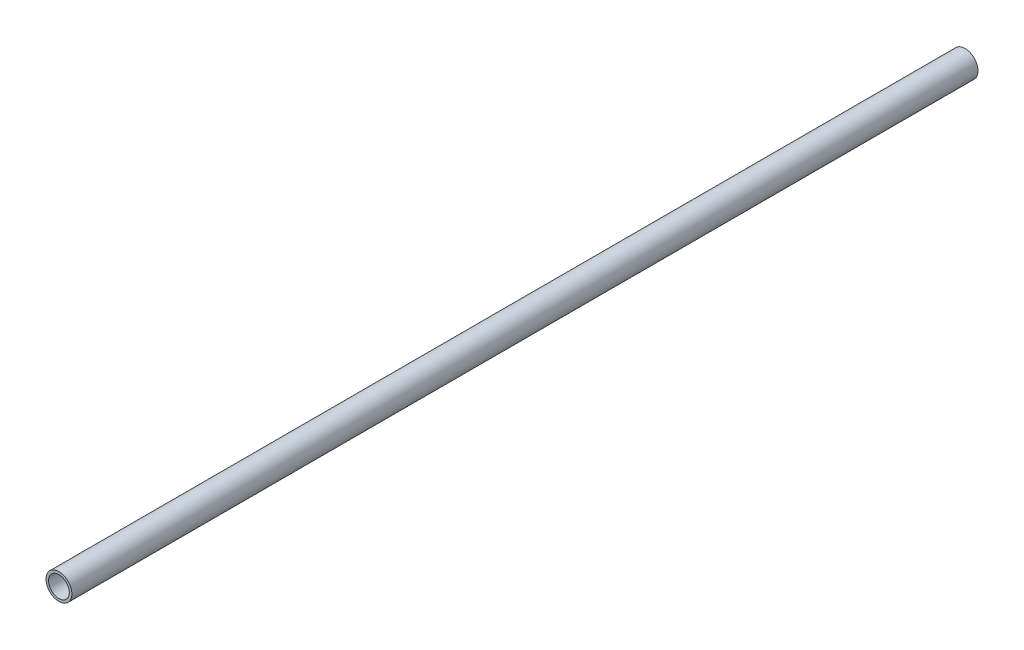
from build123d import *

# Parameters (mm, degrees)
SKETCH_1_R          = 5
EXTRUDE_1_DEPTH     = 350
SKETCH_2_R          = 4
CUT_EXTRUDE_1_DEPTH = 351.071421284


with BuildPart() as part:
    # 草图1 → 凸台-拉伸1 (new body)
    with BuildSketch(Plane.XY):
        Circle(SKETCH_1_R)
    extrude(amount=EXTRUDE_1_DEPTH)

    # 草图2 → 切除-拉伸1 (cut, through all)
    with BuildSketch(Plane(origin=(0, 0, 0), x_dir=(-1, 0, 0), z_dir=(0, 0, -1))):
        Circle(SKETCH_2_R)
    extrude(amount=-CUT_EXTRUDE_1_DEPTH, mode=Mode.SUBTRACT)


solid = part.part
